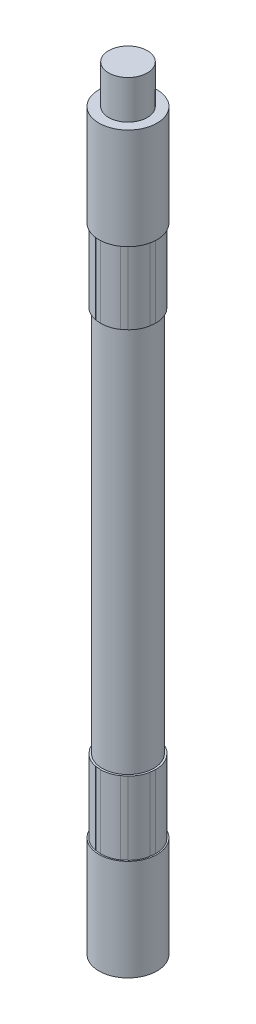
from build123d import *

# Parameters (mm, degrees)
BOSS_EXTRUDE1_DEPTH      = 180.975
BOSS_EXTRUDE1_DEPTH_BACK = 180.975
SKETCH1_R                = 14.2875
CUT_EXTRUDE1_DEPTH       = 95.25
CUT_EXTRUDE1_DEPTH_BACK  = 95.25
SKETCH2_OUTSIDE_W        = 103.416
SKETCH2_OUTSIDE_H        = 103.416
SKETCH2_OUTSIDE_R        = 12.7
CUT_EXTRUDE2_DEPTH       = 131.191
CUT_EXTRUDE2_DEPTH_BACK  = 131.191
SKETCH3_OUTSIDE_W        = 103.416
SKETCH3_OUTSIDE_H        = 103.416
SKETCH3_OUTSIDE_R        = 13.6525
SKETCH5_OUTSIDE_W        = 103.416
SKETCH5_OUTSIDE_H        = 103.416
CUT_EXTRUDE4_DEPTH       = 35.941
CUT_EXTRUDE7_START       = 35.941
SKETCH6_R                = 14.2875
CUT_EXTRUDE7_DEPTH       = 35.941
SKETCH7_R                = 9.525
BOSS_EXTRUDE2_DEPTH      = 19.05


with BuildPart() as part:
    # Sketch1 → Boss-Extrude1 (new, two sides: drawn at the far end of the back side and taken through both)
    with BuildSketch(Plane(origin=(0, 0, 0), x_dir=(1, 0, 0), z_dir=(0, 1, 0)).offset(-BOSS_EXTRUDE1_DEPTH_BACK)):
        with Locations(Location((0, 0, 0), (0, 0, 270))):
            Circle(SKETCH1_R)
    extrude(amount=BOSS_EXTRUDE1_DEPTH + BOSS_EXTRUDE1_DEPTH_BACK)

    # Sketch2 outside → Cut-Extrude1 (cut, two sides: drawn at the far end of the back side and taken through both)
    with BuildSketch(Plane(origin=(0, 0, 0), x_dir=(1, 0, 0), z_dir=(0, 1, 0)).offset(-CUT_EXTRUDE1_DEPTH_BACK)):
        Rectangle(SKETCH2_OUTSIDE_W, SKETCH2_OUTSIDE_H)
        with Locations(Location((0, 0, 0), (0, 0, 270))):
            Circle(SKETCH2_OUTSIDE_R, mode=Mode.SUBTRACT)
    extrude(amount=CUT_EXTRUDE1_DEPTH + CUT_EXTRUDE1_DEPTH_BACK, mode=Mode.SUBTRACT)

    # Sketch3 outside → Cut-Extrude2 (cut, two sides: drawn at the far end of the back side and taken through both)
    with BuildSketch(Plane(origin=(0, 0, 0), x_dir=(1, 0, 0), z_dir=(0, 1, 0)).offset(-CUT_EXTRUDE2_DEPTH_BACK)):
        Rectangle(SKETCH3_OUTSIDE_W, SKETCH3_OUTSIDE_H)
        with Locations(Location((0, 0, 0), (0, 0, 270))):
            Circle(SKETCH3_OUTSIDE_R, mode=Mode.SUBTRACT)
    extrude(amount=CUT_EXTRUDE2_DEPTH + CUT_EXTRUDE2_DEPTH_BACK, mode=Mode.SUBTRACT)

    # Sketch5 outside → Cut-Extrude4 (cut)
    with BuildSketch(Plane(origin=(0, -131.191, 0), x_dir=(1, 0, 0), z_dir=(0, 1, 0))):
        Rectangle(SKETCH5_OUTSIDE_W, SKETCH5_OUTSIDE_H)
        with BuildLine():
            Line((0, -13.6525), (0, -13.5509))
            ThreePointArc((0, -13.5509), (-1.267011069, -13.491537116), (-2.522921262, -13.313968571))
            Line((-2.522921262, -13.313968571), (-2.54183726, -13.413792141))
            ThreePointArc((-2.54183726, -13.413792141), (-6.381040136, -12.069510472), (-9.65377533, -9.65377533))
            Line((-9.65377533, -9.65377533), (-9.581933281, -9.581933281))
            ThreePointArc((-9.581933281, -9.581933281), (-10.435869502, -8.644045265), (-11.198372194, -7.630422729))
            Line((-11.198372194, -7.630422729), (-11.282333747, -7.687633021))
            ThreePointArc((-11.282333747, -7.687633021), (-13.046509451, -4.022355949), (-13.6525, 0))
            Line((-13.6525, 0), (-13.5509, 0))
            ThreePointArc((-13.5509, 0), (-13.491537116, 1.267011069), (-13.313968571, 2.522921262))
            Line((-13.313968571, 2.522921262), (-13.413792141, 2.54183726))
            ThreePointArc((-13.413792141, 2.54183726), (-12.069510472, 6.381040136), (-9.65377533, 9.65377533))
            Line((-9.65377533, 9.65377533), (-9.581933281, 9.581933281))
            ThreePointArc((-9.581933281, 9.581933281), (-8.644045265, 10.435869502), (-7.630422729, 11.198372194))
            Line((-7.630422729, 11.198372194), (-7.687633021, 11.282333747))
            ThreePointArc((-7.687633021, 11.282333747), (-4.022355949, 13.046509451), (0, 13.6525))
            Line((0, 13.6525), (0, 13.5509))
            ThreePointArc((0, 13.5509), (1.267011069, 13.491537116), (2.522921262, 13.313968571))
            Line((2.522921262, 13.313968571), (2.54183726, 13.413792141))
            ThreePointArc((2.54183726, 13.413792141), (6.381040136, 12.069510472), (9.65377533, 9.65377533))
            Line((9.65377533, 9.65377533), (9.581933281, 9.581933281))
            ThreePointArc((9.581933281, 9.581933281), (10.435869502, 8.644045265), (11.198372194, 7.630422729))
            Line((11.198372194, 7.630422729), (11.282333747, 7.687633021))
            ThreePointArc((11.282333747, 7.687633021), (13.046509451, 4.022355949), (13.6525, 0))
            Line((13.6525, 0), (13.5509, 0))
            ThreePointArc((13.5509, 0), (13.491537116, -1.267011069), (13.313968571, -2.522921262))
            Line((13.313968571, -2.522921262), (13.413792141, -2.54183726))
            ThreePointArc((13.413792141, -2.54183726), (12.069510472, -6.381040136), (9.65377533, -9.65377533))
            Line((9.65377533, -9.65377533), (9.581933281, -9.581933281))
            ThreePointArc((9.581933281, -9.581933281), (8.644045265, -10.435869502), (7.630422729, -11.198372194))
            Line((7.630422729, -11.198372194), (7.687633021, -11.282333747))
            ThreePointArc((7.687633021, -11.282333747), (4.022355949, -13.046509451), (0, -13.6525))
        make_face(mode=Mode.SUBTRACT)
    extrude(amount=CUT_EXTRUDE4_DEPTH, mode=Mode.SUBTRACT)

    # Sketch6 → Cut-Extrude7 (cut)
    with BuildSketch(Plane.XZ.offset(-131.191).offset(CUT_EXTRUDE7_START)):
        with Locations(Location((0, 0, 0), (0, 0, 90))):
            Circle(SKETCH6_R)
        with BuildLine():
            Line((-13.6525, 0), (-13.5509, 0))
            ThreePointArc((-13.5509, 0), (-13.491537116, -1.267011069), (-13.313968571, -2.522921262))
            Line((-13.313968571, -2.522921262), (-13.413792141, -2.54183726))
            ThreePointArc((-13.413792141, -2.54183726), (-12.069510472, -6.381040136), (-9.65377533, -9.65377533))
            Line((-9.65377533, -9.65377533), (-9.581933281, -9.581933281))
            ThreePointArc((-9.581933281, -9.581933281), (-8.644045265, -10.435869502), (-7.630422729, -11.198372194))
            Line((-7.630422729, -11.198372194), (-7.687633021, -11.282333747))
            ThreePointArc((-7.687633021, -11.282333747), (-4.022355949, -13.046509451), (0, -13.6525))
            Line((0, -13.6525), (0, -13.5509))
            ThreePointArc((0, -13.5509), (1.267011069, -13.491537116), (2.522921262, -13.313968571))
            Line((2.522921262, -13.313968571), (2.54183726, -13.413792141))
            ThreePointArc((2.54183726, -13.413792141), (6.381040136, -12.069510472), (9.65377533, -9.65377533))
            Line((9.65377533, -9.65377533), (9.581933281, -9.581933281))
            ThreePointArc((9.581933281, -9.581933281), (10.435869502, -8.644045265), (11.198372194, -7.630422729))
            Line((11.198372194, -7.630422729), (11.282333747, -7.687633021))
            ThreePointArc((11.282333747, -7.687633021), (13.046509451, -4.022355949), (13.6525, 0))
            Line((13.6525, 0), (13.5509, 0))
            ThreePointArc((13.5509, 0), (13.491537116, 1.267011069), (13.313968571, 2.522921262))
            Line((13.313968571, 2.522921262), (13.413792141, 2.54183726))
            ThreePointArc((13.413792141, 2.54183726), (12.069510472, 6.381040136), (9.65377533, 9.65377533))
            Line((9.65377533, 9.65377533), (9.581933281, 9.581933281))
            ThreePointArc((9.581933281, 9.581933281), (8.644045265, 10.435869502), (7.630422729, 11.198372194))
            Line((7.630422729, 11.198372194), (7.687633021, 11.282333747))
            ThreePointArc((7.687633021, 11.282333747), (4.022355949, 13.046509451), (0, 13.6525))
            Line((0, 13.6525), (0, 13.5509))
            ThreePointArc((0, 13.5509), (-1.267011069, 13.491537116), (-2.522921262, 13.313968571))
            Line((-2.522921262, 13.313968571), (-2.54183726, 13.413792141))
            ThreePointArc((-2.54183726, 13.413792141), (-6.381040136, 12.069510472), (-9.65377533, 9.65377533))
            Line((-9.65377533, 9.65377533), (-9.581933281, 9.581933281))
            ThreePointArc((-9.581933281, 9.581933281), (-10.435869502, 8.644045265), (-11.198372194, 7.630422729))
            Line((-11.198372194, 7.630422729), (-11.282333747, 7.687633021))
            ThreePointArc((-11.282333747, 7.687633021), (-13.046509451, 4.022355949), (-13.6525, 0))
        make_face(mode=Mode.SUBTRACT)
    extrude(amount=-CUT_EXTRUDE7_DEPTH, mode=Mode.SUBTRACT)

    # Sketch7 → Boss-Extrude2 (add)
    with BuildSketch(Plane(origin=(0, 180.975, 0), x_dir=(1, 0, 0), z_dir=(0, 1, 0))):
        with Locations(Location((0, 0, 0), (0, 0, 90))):
            Circle(SKETCH7_R)
    extrude(amount=BOSS_EXTRUDE2_DEPTH)


solid = part.part
